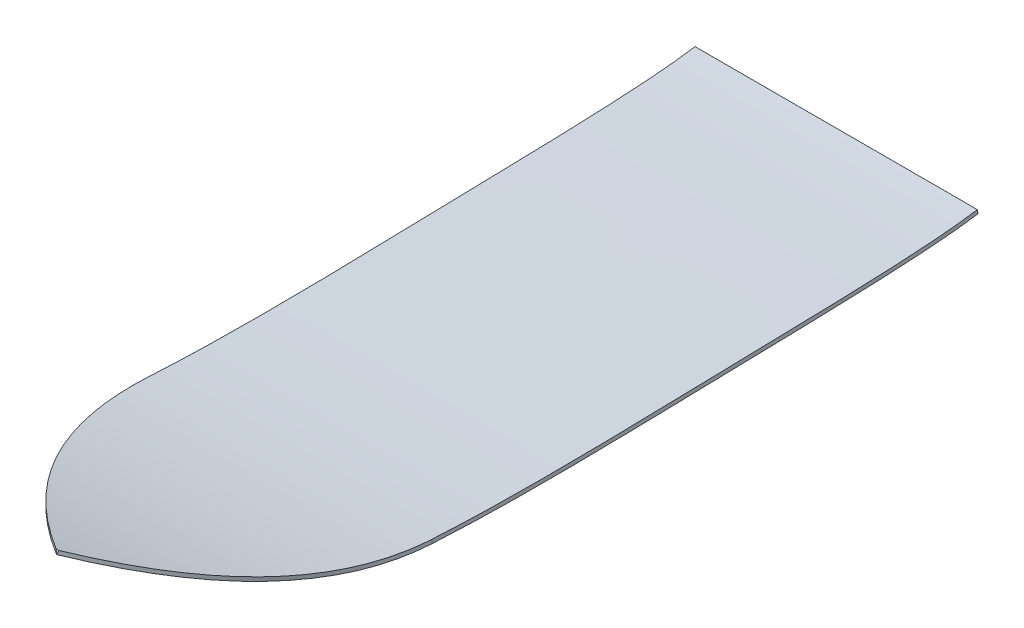
from build123d import *

# Parameters (mm, degrees)
BOSS_EXTRUDE1_DEPTH      = 1524
BOSS_EXTRUDE1_DEPTH_BACK = 1524
CUT_EXTRUDE1_DEPTH       = 3783.134525679
CUT_EXTRUDE1_DEPTH_BACK  = 3783.134525679
SKETCH3_W                = 5731.45735109
SKETCH3_H                = 8003.305882061


with BuildPart() as part:
    # Sketch1 → Boss-Extrude1 (new, two sides: drawn at the far end of the back side and taken through both)
    with BuildSketch(Plane(origin=(0, 0, 0), x_dir=(0, 0, -1), z_dir=(1, 0, 0)).offset(-BOSS_EXTRUDE1_DEPTH_BACK)):
        with BuildLine():
            Line((-3444.315129324, 11.498917078), (-3451.13843272, -12.551915148))
            add(Edge.make_bspline(
                [(-3451.13843272, -12.551915148), (-3417.639053166, -22.055803751), (-3350.403449372, -40.478143721), (-3249.462772836, -66.215517777), (-3148.764443395, -90.010250755), (-3015.345086458, -119.13881157), (-2851.103652524, -150.667061234), (-2660.483659629, -181.198441033), (-2477.913723815, -205.264022449), (-2333.129868189, -220.746604876), (-2221.78303293, -230.877305842), (-2140.468781908, -237.454730772), (-2061.345567668, -243.120484651), (-1984.277201862, -247.975692962), (-1908.446020002, -252.147614957), (-1808.849433069, -256.879466013), (-1686.73819618, -261.397559978), (-1542.912796976, -264.975186211), (-1400.884751835, -267.014141489), (-1259.88583453, -267.760449661), (-1119.227097025, -267.421049208), (-978.301600219, -266.15865218), (-836.499082194, -264.135966892), (-693.221937812, -261.482975147), (-547.873000698, -258.330286564), (-399.807366185, -254.796376324), (-273.567982341, -251.633162062), (-170.465696858, -249.032604687), (-91.978816875, -247.062778882), (-12.213642182, -245.089466134), (69.014812877, -243.134527849), (150.895303085, -241.206654674), (260.736070178, -238.622741529), (398.666162012, -235.295617715), (563.287602612, -230.912008801), (725.081875829, -225.889617858), (882.082333403, -219.978699907), (1007.269506745, -214.101342012), (1103.033746255, -208.699921697), (1172.416274508, -204.266605485), (1239.11116652, -199.418286414), (1302.875439975, -194.122153988), (1353.369727191, -189.307565189), (1392.061106481, -185.197788485), (1420.198506584, -181.981854599), (1447.425851602, -178.62765783), (1469.333588132, -175.713154296), (1486.376215034, -173.307466349), (1498.91466188, -171.465204494), (1509.152009374, -169.898651752), (1517.226084865, -168.624177509), (1521.20272254, -167.983305382), (1523.197789603, -167.658374977)],
                knots=[0.002321774, 0.002321774, 0.002321774, 0.002321774, 0.017910496, 0.033499218, 0.04908794, 0.064676663, 0.095854107, 0.127031552, 0.158208996, 0.189386441, 0.204975163, 0.220563886, 0.236152608, 0.25174133, 0.267330052, 0.282918775, 0.314096219, 0.345273664, 0.376451108, 0.407628553, 0.438805998, 0.469983442, 0.501160887, 0.532338331, 0.563515776, 0.59469322, 0.625870665, 0.641459387, 0.65704811, 0.672636832, 0.688225554, 0.703814277, 0.719402999, 0.750580443, 0.781757888, 0.812935333, 0.844112777, 0.875290222, 0.890878944, 0.906467666, 0.922056389, 0.937645111, 0.953233833, 0.961028194, 0.968822555, 0.976616917, 0.984411278, 0.988308458, 0.992205639, 0.996102819, 0.99805141, 1, 1, 1, 1], degree=3))
            Line((1523.197789603, -167.658374977), (1519.179067606, -142.983491522))
            add(Edge.make_bspline(
                [(-3444.315129324, 11.498917078), (-3382.383566919, -6.071279085), (-3252.922516037, -40.471221751), (-3090.449265264, -77.757955836), (-2958.392850989, -104.595591316), (-2828.035678488, -128.896548112), (-2669.013958066, -154.686187498), (-2486.126509274, -179.105727671), (-2297.493137907, -199.548011885), (-2167.599544825, -210.416770388), (-2088.515451786, -216.083603631), (-2052.513561257, -218.583382931), (-2020.283723685, -220.662141031), (-1943.616782245, -225.295923956), (-1840.096064833, -230.652296867), (-1693.381315615, -236.180757911), (-1549.393922947, -239.843997188), (-1407.215370474, -241.951604467), (-1219.019572206, -243.019243016), (-984.623120735, -241.610798631), (-747.273654031, -237.638066689), (-553.221702442, -233.446466957), (-404.950713904, -229.915498812), (-253.239806425, -226.117126886), (-123.28057304, -222.83120558), (-16.761833947, -220.19311958), (64.621003299, -218.231801777), (201.380759582, -215.009995971), (367.470127013, -211.111279213), (559.915422498, -205.99836078), (722.01015667, -200.980065715), (931.672591049, -193.107564165), (1225.590236123, -177.8815201), (1424.995778664, -158.322832667), (1519.179067606, -142.983491522)],
                knots=[0.002321774, 0.002321774, 0.002321774, 0.002321774, 0.03125, 0.0625, 0.078125, 0.09375, 0.125, 0.15625, 0.1875, 0.2265625, 0.23046875, 0.234375, 0.248046875, 0.25, 0.28125, 0.3125, 0.34375, 0.375, 0.40625, 0.46875, 0.53125, 0.5625, 0.59375, 0.625, 0.65625, 0.671875, 0.6875, 0.703125, 0.75, 0.78125, 0.8125, 0.84375, 0.90625, 1, 1, 1, 1], degree=3))
        make_face()
    extrude(amount=BOSS_EXTRUDE1_DEPTH + BOSS_EXTRUDE1_DEPTH_BACK)

    # Sketch3 → Cut-Extrude1 (cut, two sides: drawn at the far end of the back side and taken through both)
    with BuildSketch(Plane(origin=(0, 0, 0), x_dir=(1, 0, 0), z_dir=(0, 1, 0)).offset(-CUT_EXTRUDE1_DEPTH_BACK)):
        with Locations((-68.47307406, 388.006471624)):
            Rectangle(SKETCH3_W, SKETCH3_H)
        with BuildLine():
            Line((-900, 1559.397955558), (900, 1559.397955558))
            Line((900, 1559.397955558), (900, -1958.135694994))
            add(Edge.make_bspline(
                [(900, -1958.135694994), (900, -2832.774300177), (0, -3451.13843272)],
                knots=[0, 0, 0, 1, 1, 1], degree=2))
            add(Edge.make_bspline(
                [(-900, -1958.135694994), (-900, -2832.774300177), (0, -3451.13843272)],
                knots=[0, 0, 0, 1, 1, 1], degree=2))
            Line((-900, -1958.135694994), (-900, 1559.397955558))
        make_face(mode=Mode.SUBTRACT)
    extrude(amount=CUT_EXTRUDE1_DEPTH + CUT_EXTRUDE1_DEPTH_BACK, mode=Mode.SUBTRACT)


solid = part.part
